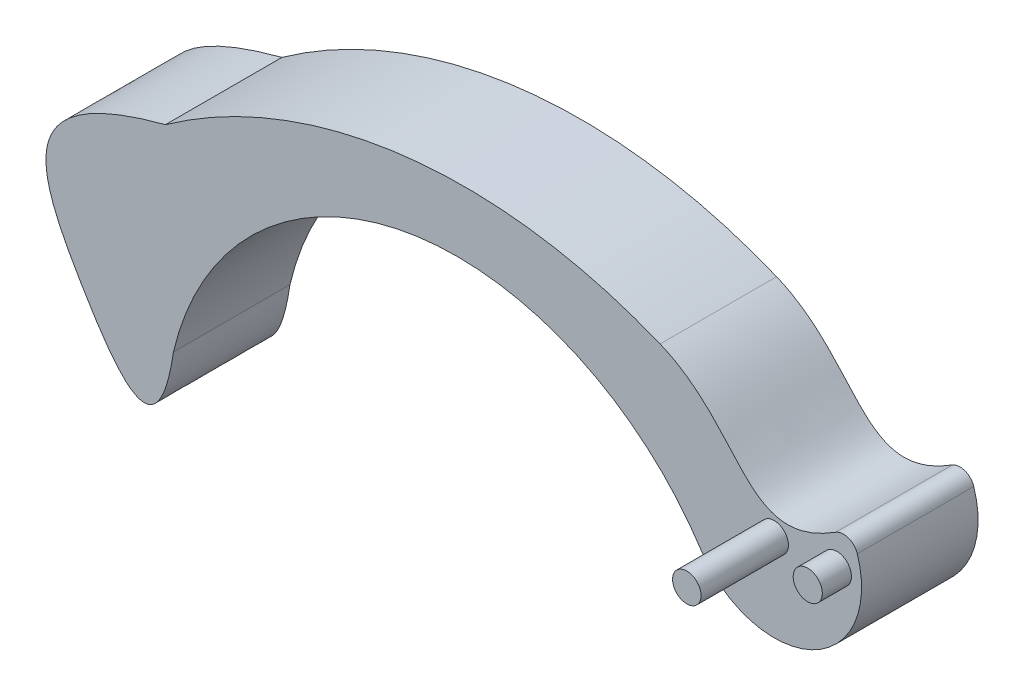
from build123d import *

# Parameters (mm, degrees)
EXTRUDE_1_DEPTH = 40
FILLET_1_R      = 5
SKETCH_2_R      = 5
EXTRUDE_2_DEPTH = 10
SKETCH_3_R      = 4.895354235
EXTRUDE_3_DEPTH = 30


with BuildPart() as part:
    # 草图1 → 凸台-拉伸1 (new body)
    with BuildSketch(Plane.XY):
        with BuildLine():
            ThreePointArc((5.298924233, 15.21006088), (-4.753279677, -25.505505888), (-45.688242176, -16.387774488))
            ThreePointArc((-45.688242176, -16.387774488), (-146.722291952, 27.502807651), (-226.811353191, -48.127904925))
            add(Edge.make_bspline(
                [(-226.811353191, -48.127904925), (-232.171148588, -84.685316591), (-269.798080997, -29.139192175), (-283.009548959, 4.044745309), (-229.546733983, 18.104203538)],
                knots=[0, 0, 0, 0, 0.380868914, 1, 1, 1, 1], degree=3))
            ThreePointArc((-229.546733983, 18.104203538), (-147.18059155, 49.852575787), (-59.732589489, 37.811500446))
            add(Edge.make_bspline(
                [(5.298924233, 15.21006088), (-30.412417087, -10.923043058), (-29.671088016, 25.482582404), (-59.732589489, 37.811500446)],
                knots=[0, 0, 0, 0, 1, 1, 1, 1], degree=3))
        make_face()
    extrude(amount=EXTRUDE_1_DEPTH)

    # 圆角1
    fillet_1_edges = [part.edges().sort_by_distance(p)[0] for p in [
        (5.298924233, 15.21006088, 20),
    ]]
    fillet(fillet_1_edges, radius=FILLET_1_R)

    # 草图2 → 凸台-拉伸2 (add)
    with BuildSketch(Plane(origin=(3.130153076, 1.250725173, 40), x_dir=(1, 0, 0), z_dir=(0, 0, 1))):
        with Locations((-2.163474259, 0.247591508)):
            Circle(SKETCH_2_R)
    extrude(amount=EXTRUDE_2_DEPTH)

    # 草图3 → 凸台-拉伸3 (add)
    with BuildSketch(Plane.XY.offset(40)):
        with Locations((-20.556336683, -0.005243355)):
            Circle(SKETCH_3_R)
    extrude(amount=EXTRUDE_3_DEPTH)


solid = part.part
